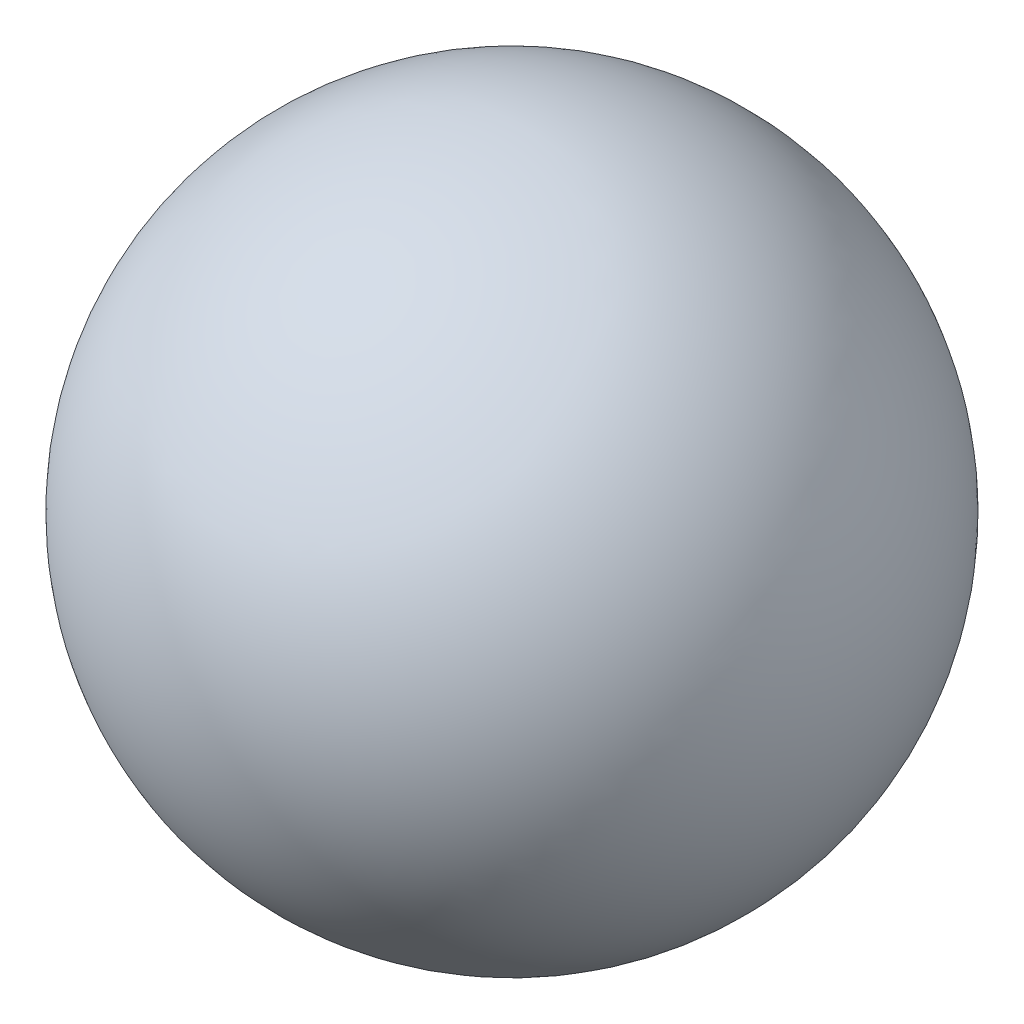
from build123d import *

# Parameters (mm, degrees)
M4X0_7_TAPPED_HOLE1_D     = 3.3
M4X0_7_TAPPED_HOLE1_DEPTH = 5
M4X0_7_TAPPED_HOLE1_TIP   = 0.991420021


with BuildPart() as part:
    # Sketch2 → Revolve1 (revolve)
    with BuildSketch(Plane(origin=(0, 0, 0), x_dir=(1, 0, 0), z_dir=(0, 1, 0))):
        with BuildLine():
            Line((2.179449472, 9.5), (0, 9.5))
            Line((0, 9.5), (0, 0))
            ThreePointArc((0, 0), (4.873397172, 3.881966011), (2.179449472, 9.5))
        make_face()
    revolve(axis=Axis((0, 0, -9.5), (0, 0, 1)))

    # M4x0.7 Tapped Hole1
    with Locations(Plane(origin=(0, 0, -9.5), x_dir=(-1, 0, 0), z_dir=(0, 0, -1))):
        with Locations((0, 0)):
            Hole(M4X0_7_TAPPED_HOLE1_D / 2, depth=M4X0_7_TAPPED_HOLE1_DEPTH)
            with Locations((0, 0, -(M4X0_7_TAPPED_HOLE1_DEPTH + M4X0_7_TAPPED_HOLE1_TIP / 2))):  # 118° drill point
                Cone(0, M4X0_7_TAPPED_HOLE1_D / 2, M4X0_7_TAPPED_HOLE1_TIP, mode=Mode.SUBTRACT)


solid = part.part
